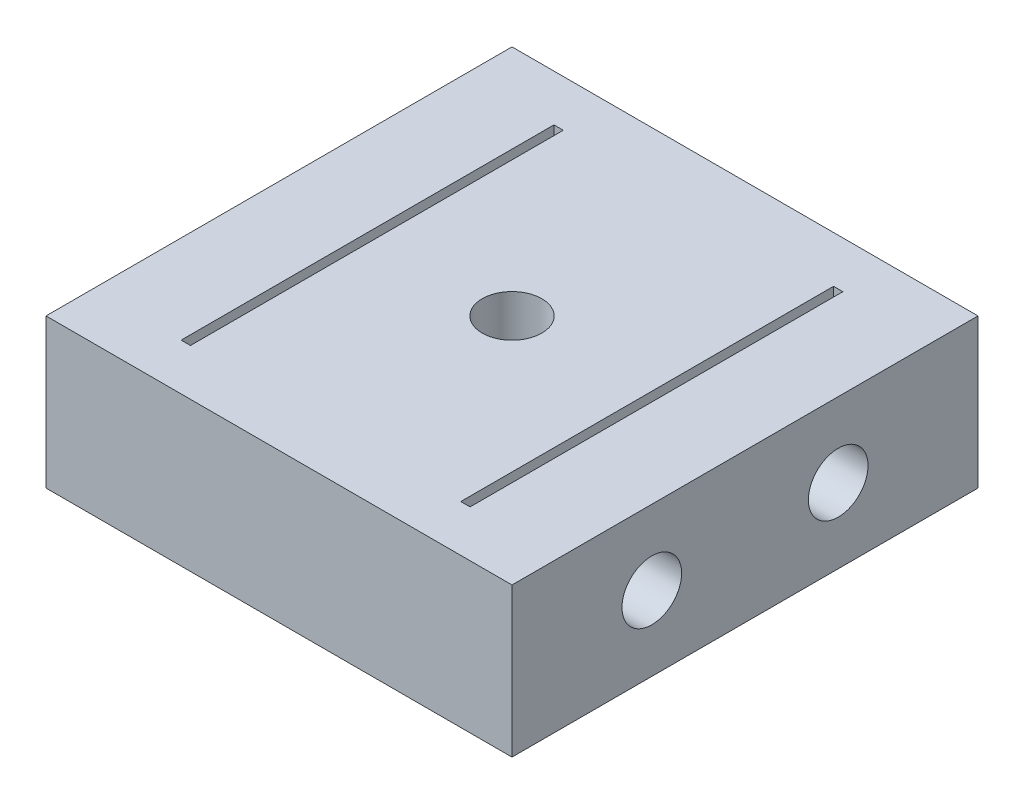
from build123d import *

# Parameters (mm, degrees)
SKETCH2_W           = 25
SKETCH2_H           = 25
SKETCH2_R           = 1.6
SKETCH2_W_2         = 0.5
SKETCH2_H_2         = 20
BOSS_EXTRUDE1_DEPTH = 8
SKETCH3_R           = 1.6
CUT_EXTRUDE1_DEPTH  = 37.249137921


with BuildPart() as part:
    # Sketch2 → Boss-Extrude1 (new body)
    with BuildSketch(Plane(origin=(0, 0, 0), x_dir=(1, 0, 0), z_dir=(0, 1, 0))):
        with Locations((12.5, 12.5)):
            Rectangle(SKETCH2_W, SKETCH2_H)
        with Locations(Location((12.5, 12.5, 0), (0, 0, 270))):
            Circle(SKETCH2_R, mode=Mode.SUBTRACT)
        with Locations((5, 12.5)):
            Rectangle(SKETCH2_W_2, SKETCH2_H_2, mode=Mode.SUBTRACT)
        with Locations((20, 12.5)):
            Rectangle(SKETCH2_W_2, SKETCH2_H_2, mode=Mode.SUBTRACT)
    extrude(amount=BOSS_EXTRUDE1_DEPTH)

    # Sketch3 → Cut-Extrude1 (cut, through all)
    with BuildSketch(Plane(origin=(25, 0, 0), x_dir=(0, 0, -1), z_dir=(1, 0, 0))):
        with Locations((7.5, 4)):
            Circle(SKETCH3_R)
        with Locations((17.5, 4)):
            Circle(SKETCH3_R)
    extrude(amount=-CUT_EXTRUDE1_DEPTH, mode=Mode.SUBTRACT)


solid = part.part
